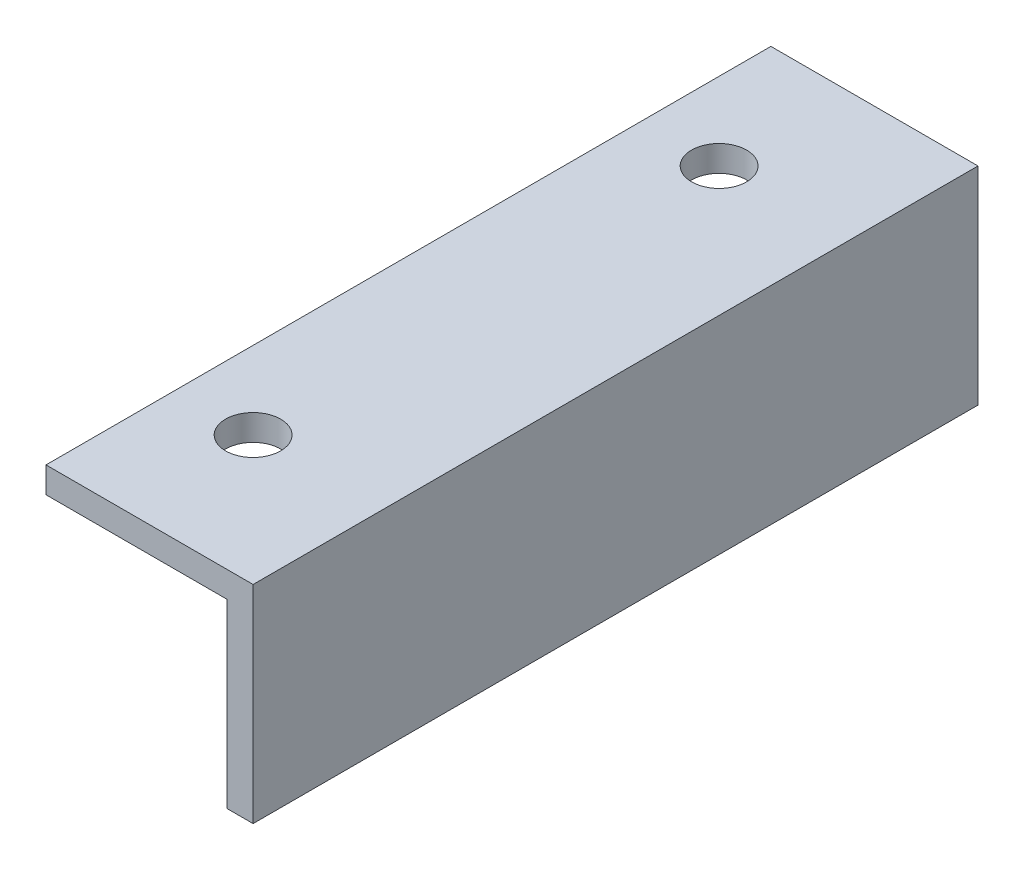
from build123d import *

# Parameters (mm, degrees)
BOSS_EXTRUDE1_DEPTH = 88.9
SKETCH2_R           = 3.3782
CUT_EXTRUDE1_DEPTH  = 96.882897328


with BuildPart() as part:
    # Sketch1 → Boss-Extrude1 (new body)
    with BuildSketch(Plane.XY):
        Polygon((0, 0), (0, 25.4), (-25.4, 25.4), (-25.4, 22.225), (-3.175, 22.225), (-3.175, 0), align=None)
    extrude(amount=BOSS_EXTRUDE1_DEPTH)

    # Sketch2 → Cut-Extrude1 (cut, through all)
    with BuildSketch(Plane(origin=(0, 25.4, 0), x_dir=(1, 0, 0), z_dir=(0, 1, 0))):
        with Locations(Location((-15.875, -15.875, 0), (0, 0, 180))):
            Circle(SKETCH2_R)
        with Locations(Location((-15.875, -73.025, 0), (0, 0, 180))):
            Circle(SKETCH2_R)
    extrude(amount=-CUT_EXTRUDE1_DEPTH, mode=Mode.SUBTRACT)


solid = part.part
